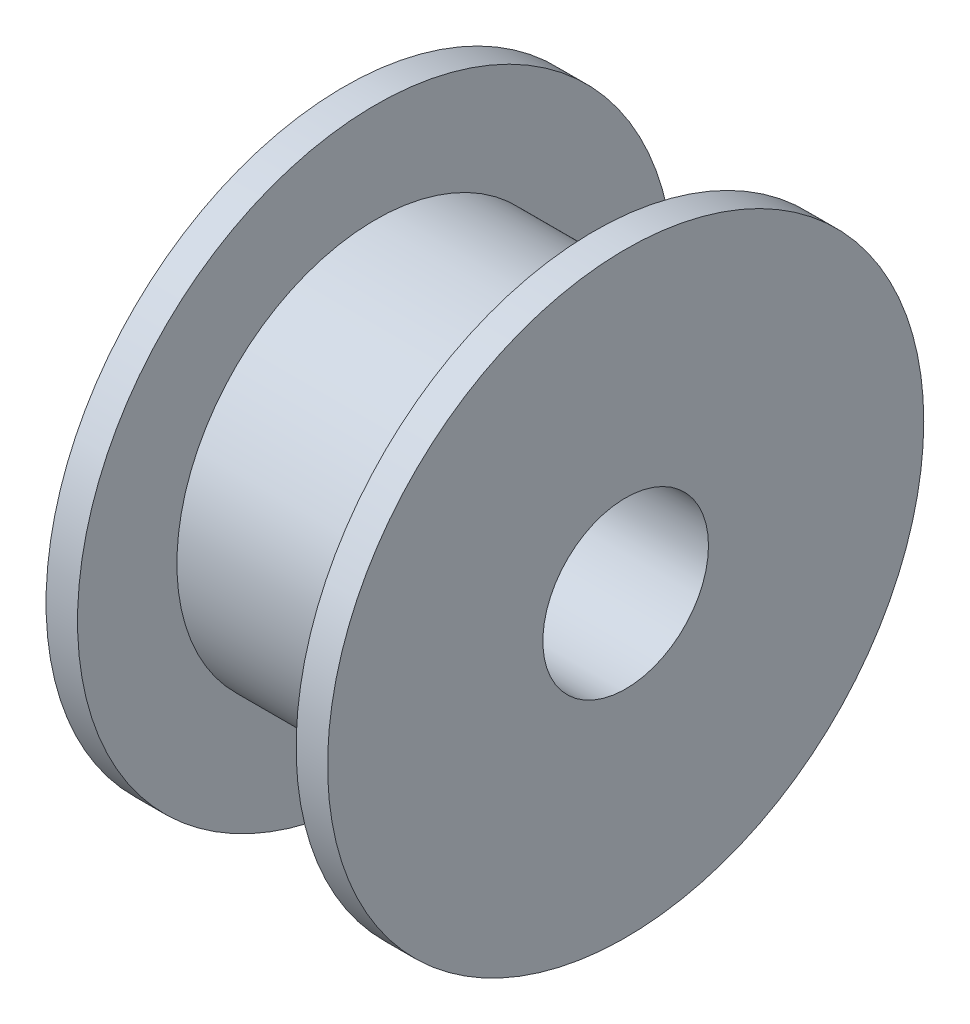
from build123d import *


with BuildPart() as part:
    # Sketch1 → Revolve1 (revolve)
    with BuildSketch(Plane.XY, mode=Mode.PRIVATE) as revolve1_sk:
        Polygon((0, 2.5), (0, 9), (0.95, 9), (0.95, 6), (7.55, 6), (7.55, 9), (8.5, 9), (8.5, 2.5), align=None)
    revolve(revolve1_sk.sketch.rotate(Axis((0, 0, 0), (-1, 0, 0)), 90), axis=Axis((0, 0, 0), (-1, 0, 0)))


solid = part.part
